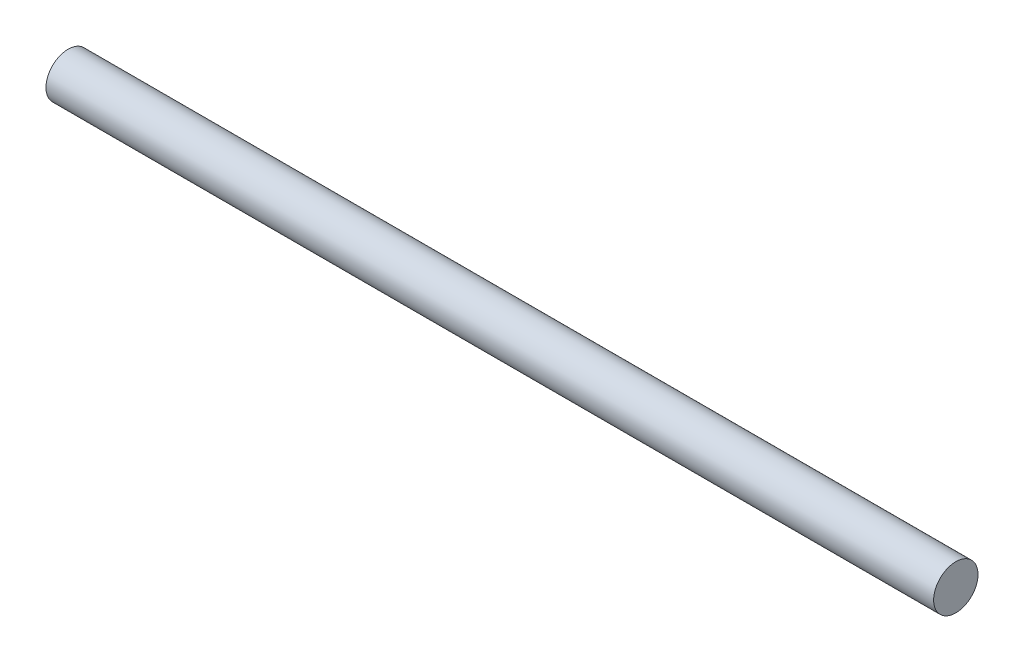
from build123d import *

# Parameters (mm, degrees)
SKETCH1_R           = 2.5
BOSS_EXTRUDE1_DEPTH = 100


with BuildPart() as part:
    # Sketch1 → Boss-Extrude1 (new body)
    with BuildSketch(Plane(origin=(0, 0, 0), x_dir=(0, 0, -1), z_dir=(1, 0, 0))):
        Circle(SKETCH1_R)
    extrude(amount=BOSS_EXTRUDE1_DEPTH)


solid = part.part
